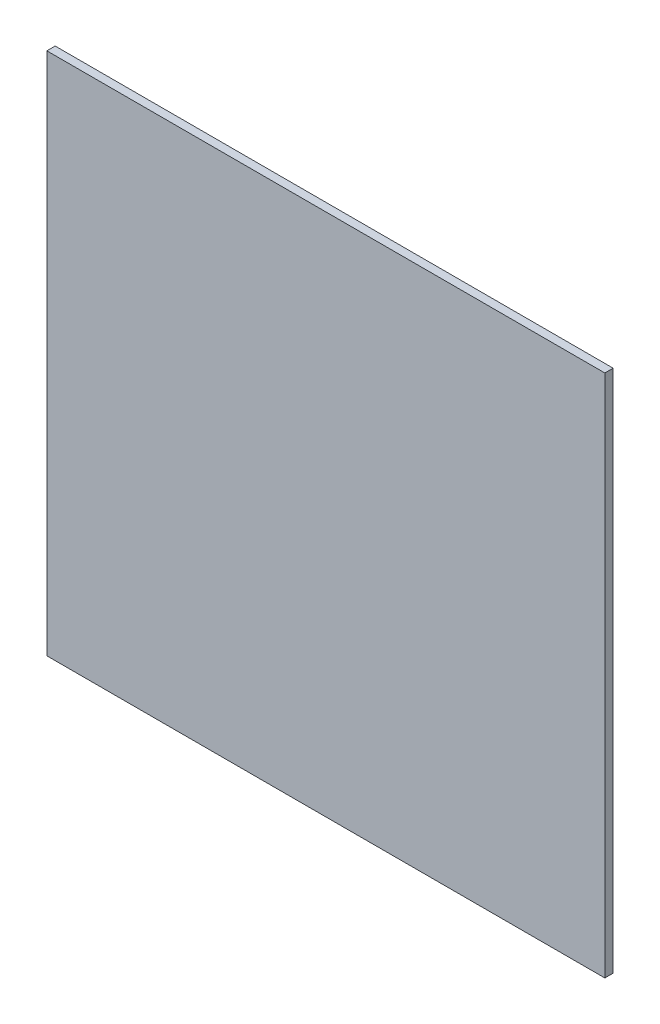
from build123d import *

# Parameters (mm, degrees)
SKETCH1_W           = 213
SKETCH1_H           = 200
BOSS_EXTRUDE1_DEPTH = 3.175


with BuildPart() as part:
    # Sketch1 → Boss-Extrude1 (new body)
    with BuildSketch(Plane.XY):
        Rectangle(SKETCH1_W, SKETCH1_H)
    extrude(amount=BOSS_EXTRUDE1_DEPTH)


solid = part.part
